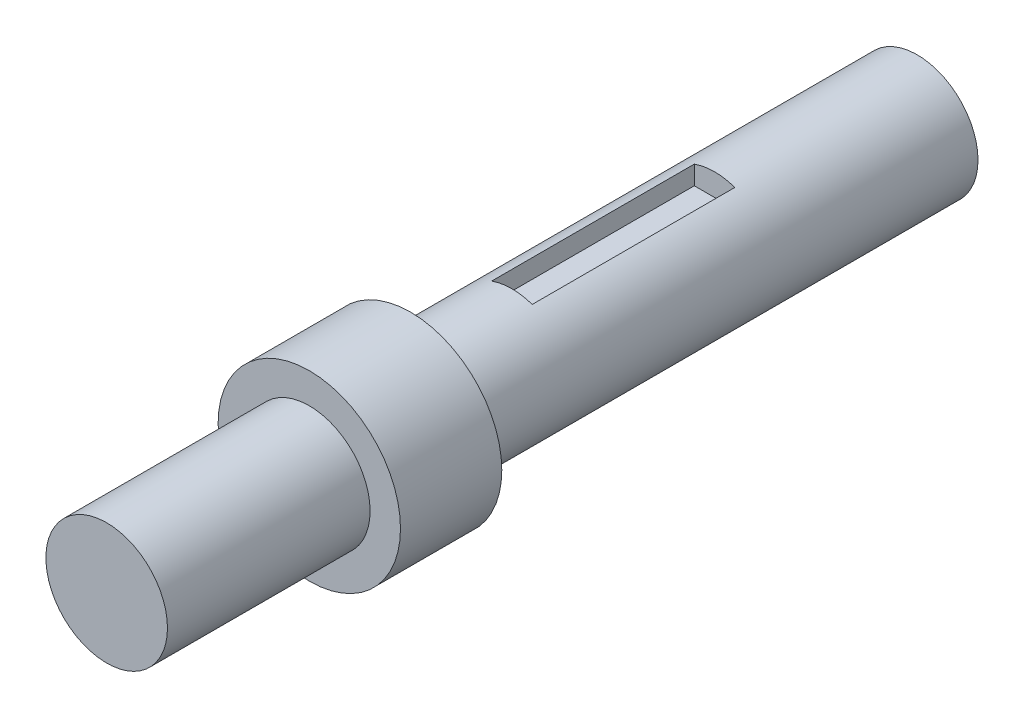
from build123d import *

# Parameters (mm, degrees)
SKETCH2_R           = 6
BOSS_EXTRUDE1_DEPTH = 50
SKETCH3_R           = 9
BOSS_EXTRUDE2_DEPTH = 10
SKETCH4_R           = 6
BOSS_EXTRUDE3_DEPTH = 20
SKETCH6_W           = 4
SKETCH6_H           = 20
CUT_EXTRUDE1_DEPTH  = 2.2


with BuildPart() as part:
    # Sketch2 → Boss-Extrude1 (new body)
    with BuildSketch(Plane.XY):
        Circle(SKETCH2_R)
    extrude(amount=BOSS_EXTRUDE1_DEPTH)

    # Sketch3 → Boss-Extrude2 (add)
    with BuildSketch(Plane.XY.offset(50)):
        Circle(SKETCH3_R)
    extrude(amount=BOSS_EXTRUDE2_DEPTH)

    # Sketch4 → Boss-Extrude3 (add)
    with BuildSketch(Plane.XY.offset(60)):
        Circle(SKETCH4_R)
    extrude(amount=BOSS_EXTRUDE3_DEPTH)

    # Sketch6 → Cut-Extrude1 (cut)
    with BuildSketch(Plane(origin=(0, 6, 0), x_dir=(1, 0, 0), z_dir=(0, 1, 0))):
        with Locations((0, -30)):
            Rectangle(SKETCH6_W, SKETCH6_H)
    extrude(amount=-CUT_EXTRUDE1_DEPTH, mode=Mode.SUBTRACT)


solid = part.part
